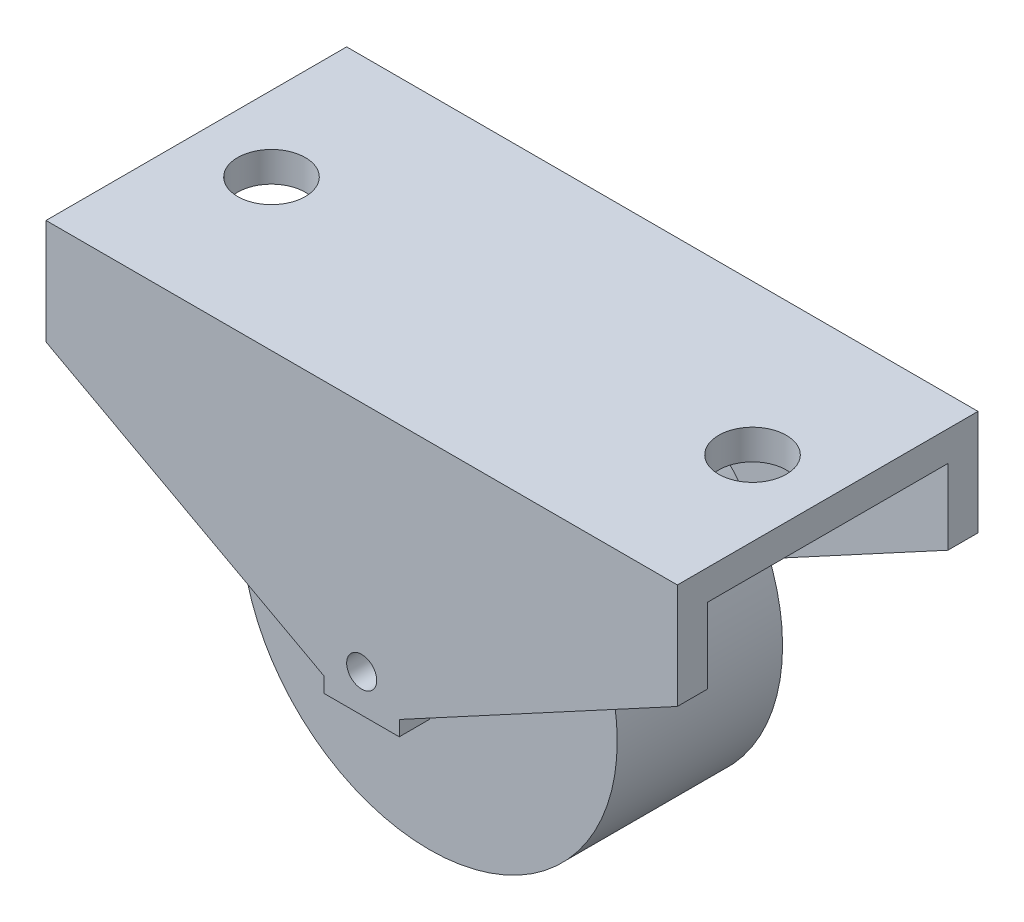
from build123d import *

# Parameters (mm, degrees)
SKETCH_1_W               = 42
SKETCH_1_H               = 20
SKETCH_1_R               = 2.25
EXTRUDE_1_DEPTH          = 2
EXTRUDE_START            = -5.5
SKETCH_2_R               = 12.5
EXTRUDE_2_DEPTH          = 11
EXTRUDE_3_DEPTH          = 2
PATTERN_LINEAR_1_COUNT   = 2
PATTERN_LINEAR_1_PITCH   = 18
CUT_EXTRUDE_1_DEPTH      = 38.960505792
CUT_EXTRUDE_1_DEPTH_BACK = 38.960505792
SKETCH_4_R               = 1


with BuildPart() as part:
    # Эскиз1 → Бобышка-Вытянуть1 (new body)
    with BuildSketch(Plane(origin=(0, 0, 0), x_dir=(1, 0, 0), z_dir=(0, 1, 0))):
        Rectangle(SKETCH_1_W, SKETCH_1_H)
        with Locations(Location((-16, 0, 0), (0, 0, 270))):
            Circle(SKETCH_1_R, mode=Mode.SUBTRACT)
        with Locations(Location((16, 0, 0), (0, 0, 270))):
            Circle(SKETCH_1_R, mode=Mode.SUBTRACT)
    extrude(amount=EXTRUDE_1_DEPTH)

    # Эскиз3 → Бобышка-Вытянуть3 (add)
    with BuildSketch(Plane.XY.offset(10)):
        Polygon((-21, -5), (-2.5, -15), (-2.5, -16), (2.5, -16), (2.5, -15), (21, -5), (21, 0), (-21, 0), align=None)
    extrude_3 = extrude(amount=-EXTRUDE_3_DEPTH)

    # Линейный массив1: Бобышка-Вытянуть3 ×2
    with Locations(*[(0, 0, -i * PATTERN_LINEAR_1_PITCH) for i in range(1, PATTERN_LINEAR_1_COUNT)]):
        add(extrude_3)

    # Эскиз4 → Вырез-Вытянуть1 (cut, two sides: drawn at the far end of the back side and taken through both)
    with BuildSketch(Plane.XY.offset(-8).offset(-CUT_EXTRUDE_1_DEPTH_BACK)):
        with Locations((0, -13.5)):
            Circle(SKETCH_4_R)
    extrude(amount=CUT_EXTRUDE_1_DEPTH + CUT_EXTRUDE_1_DEPTH_BACK, mode=Mode.SUBTRACT)


with BuildPart() as body_2:
    # Эскиз2 → Бобышка-Вытянуть2 (new body)
    with BuildSketch(Plane.XY.offset(EXTRUDE_START)):
        with Locations((0, -13.5)):
            Circle(SKETCH_2_R)
    extrude(amount=EXTRUDE_2_DEPTH)


solid = Compound([part.part, body_2.part])
